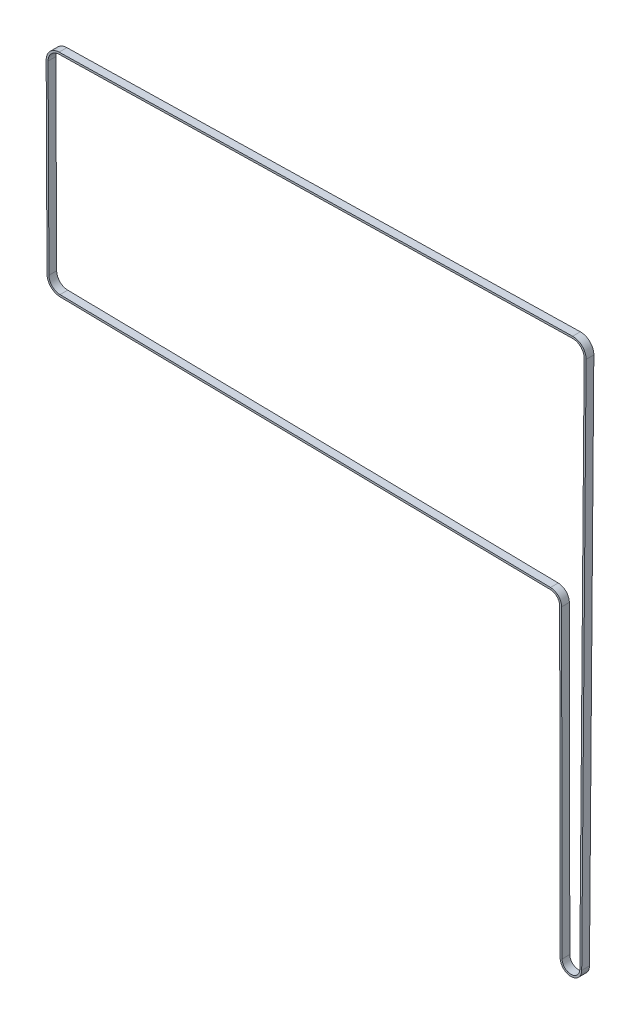
from build123d import *

# Parameters (mm, degrees)
EXTRUDE_1_DEPTH = 6


with BuildPart() as part:
    # Эскиз1 → Вытянуть-Тонкостенный1 (new body)
    with BuildSketch(Plane.XY):
        with BuildLine():
            Line((-8.750009946, 236.236316306), (-8.358688534, -0.013845213))
            ThreePointArc((-8.358688534, -0.013845213), (-0.027478742, -8.358654832), (8.358416834, -0.068802026))
            Line((8.358416834, -0.068802026), (11.749652763, 411.915630331))
            ThreePointArc((11.749652763, 411.915630331), (8.702090663, 419.293311326), (1.28663844, 422.247779119))
            Line((1.28663844, 422.247779119), (-396.860570527, 413.958245474))
            ThreePointArc((-396.860570527, 413.958245474), (-403.986255954, 410.865946027), (-406.897104697, 403.664233156))
            Line((-406.897104697, 403.664233156), (-406.249895731, 260.178074325))
            ThreePointArc((-406.249895731, 260.178074325), (-403.293312438, 253.022217989), (-396.175234336, 249.975805541))
            Line((-396.175234336, 249.975805541), (-15.876053763, 243.473247954))
            ThreePointArc((-15.876053763, 243.473247954), (-10.834051004, 241.311101307), (-8.750009946, 236.236316306))
        make_face()
        with BuildLine():
            Line((-7.250012003, 236.238800882), (-6.858690591, -0.011360638))
            ThreePointArc((-6.858690591, -0.011360638), (-0.022547579, -6.858662938), (6.858467649, -0.056455245))
            Line((6.858467649, -0.056455245), (10.249703578, 411.927977112))
            ThreePointArc((10.249703578, 411.927977112), (7.648126176, 418.225997474), (1.317862083, 420.748104126))
            Line((1.317862083, 420.748104126), (-396.829346884, 412.458570482))
            ThreePointArc((-396.829346884, 412.458570482), (-402.912249078, 409.81880266), (-405.397119956, 403.67099899))
            Line((-405.397119956, 403.67099899), (-404.74991099, 260.184840159))
            ThreePointArc((-404.74991099, 260.184840159), (-402.225998422, 254.076182312), (-396.149590287, 251.475586319))
            Line((-396.149590287, 251.475586319), (-15.850409713, 244.973028732))
            ThreePointArc((-15.850409713, 244.973028732), (-9.765233971, 242.3635414), (-7.250012003, 236.238800882))
        make_face(mode=Mode.SUBTRACT)
    extrude(amount=EXTRUDE_1_DEPTH)


solid = part.part
